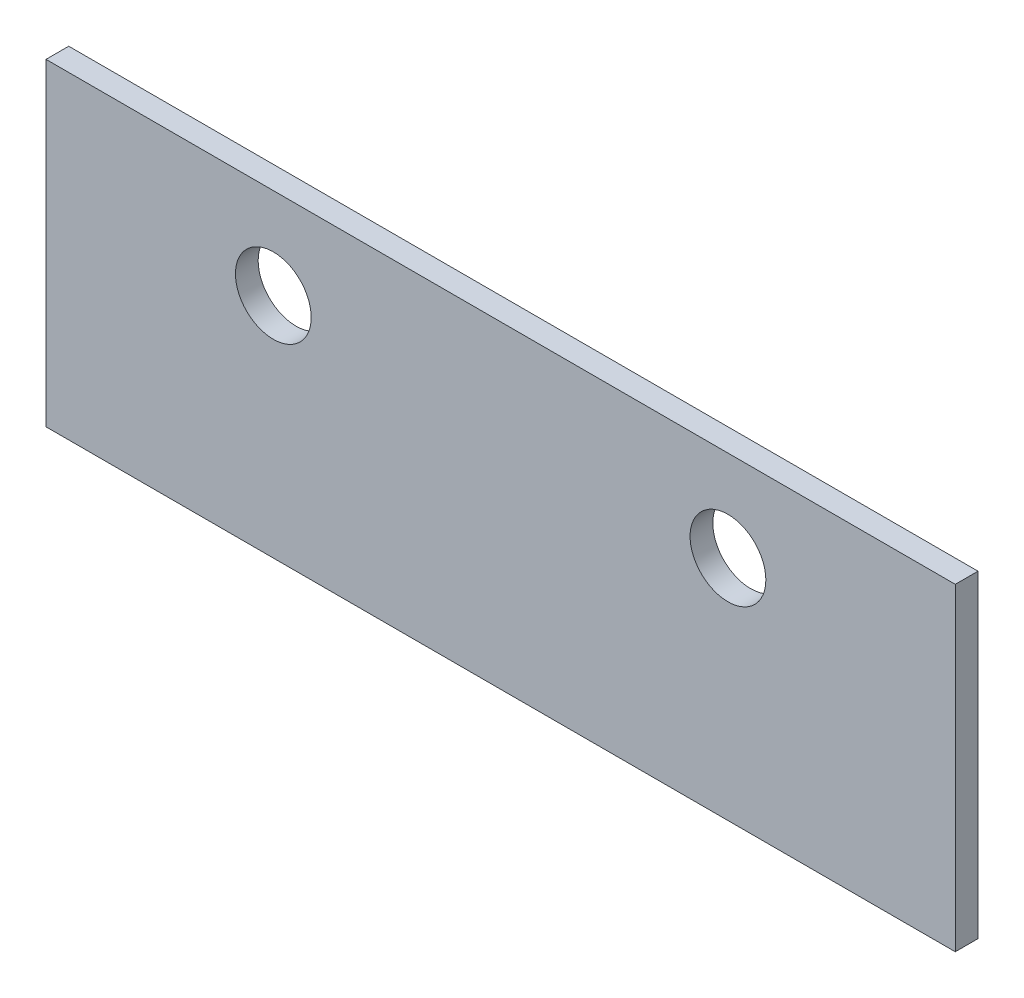
from build123d import *

# Parameters (mm, degrees)
ESQUISSE1_W             = 60
ESQUISSE1_H             = 21
BASE_EXTRUSION_DEPTH    = 1.5
ESQUISSE2_R             = 2.5
ENL_V_MAT_EXTRU_1_DEPTH = 2


with BuildPart() as part:
    # Esquisse1 → Base-Extrusion (new body)
    with BuildSketch(Plane.XY):
        with Locations((30, 10.5)):
            Rectangle(ESQUISSE1_W, ESQUISSE1_H)
    extrude(amount=BASE_EXTRUSION_DEPTH)

    # Esquisse2 → Enlèv. mat.-Extru.1 (cut)
    with BuildSketch(Plane.XY.offset(1.5)):
        with Locations((15, 15)):
            Circle(ESQUISSE2_R)
        with Locations((45, 15)):
            Circle(ESQUISSE2_R)
    extrude(amount=-ENL_V_MAT_EXTRU_1_DEPTH, mode=Mode.SUBTRACT)


solid = part.part
